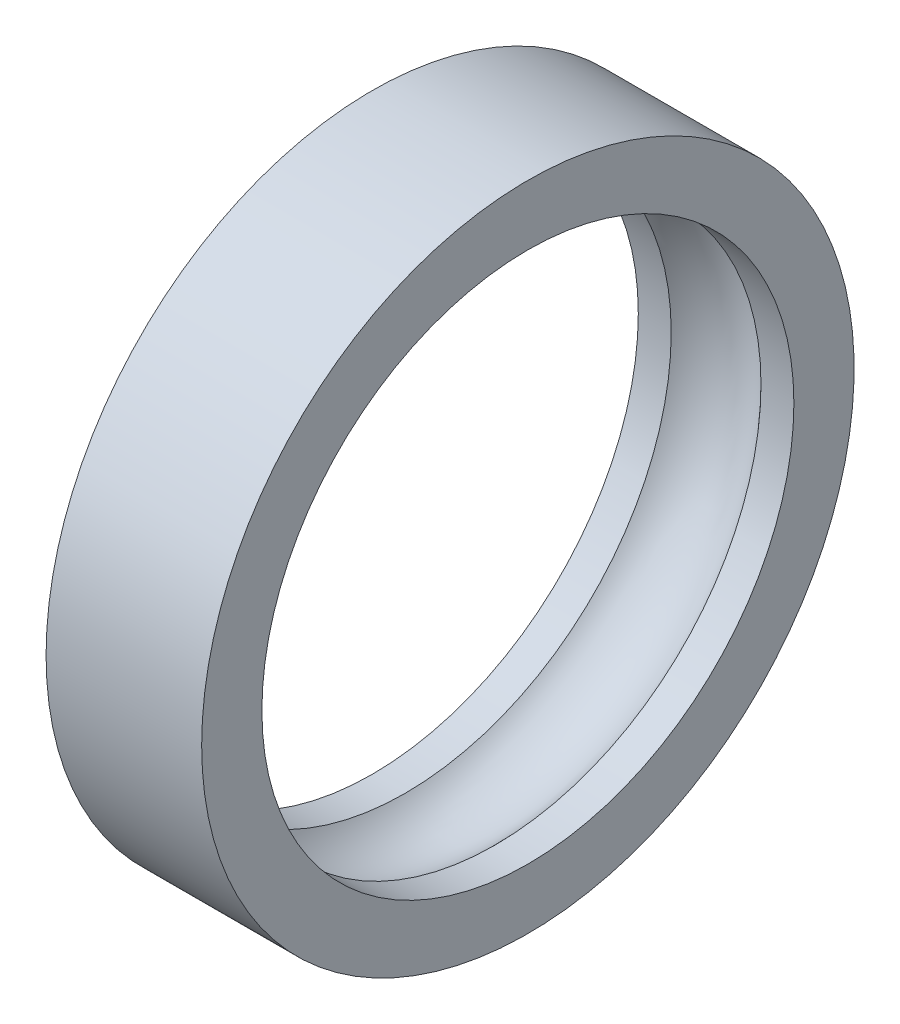
from build123d import *


with BuildPart() as part:
    # Sketch1 → Revolve1 (revolve)
    with BuildSketch(Plane.XY, mode=Mode.PRIVATE) as revolve1_sk:
        with BuildLine():
            Line((-8.94427191, 53), (-15.5, 53))
            Line((-15.5, 53), (-15.5, 65))
            Line((-15.5, 65), (15.5, 65))
            Line((15.5, 65), (15.5, 53))
            Line((15.5, 53), (8.94427191, 53))
            ThreePointArc((8.94427191, 53), (0, 57), (-8.94427191, 53))
        make_face()
    revolve(revolve1_sk.sketch.rotate(Axis((-15.5, 0, 0), (1, 0, 0)), 90), axis=Axis((-15.5, 0, 0), (1, 0, 0)))


solid = part.part
